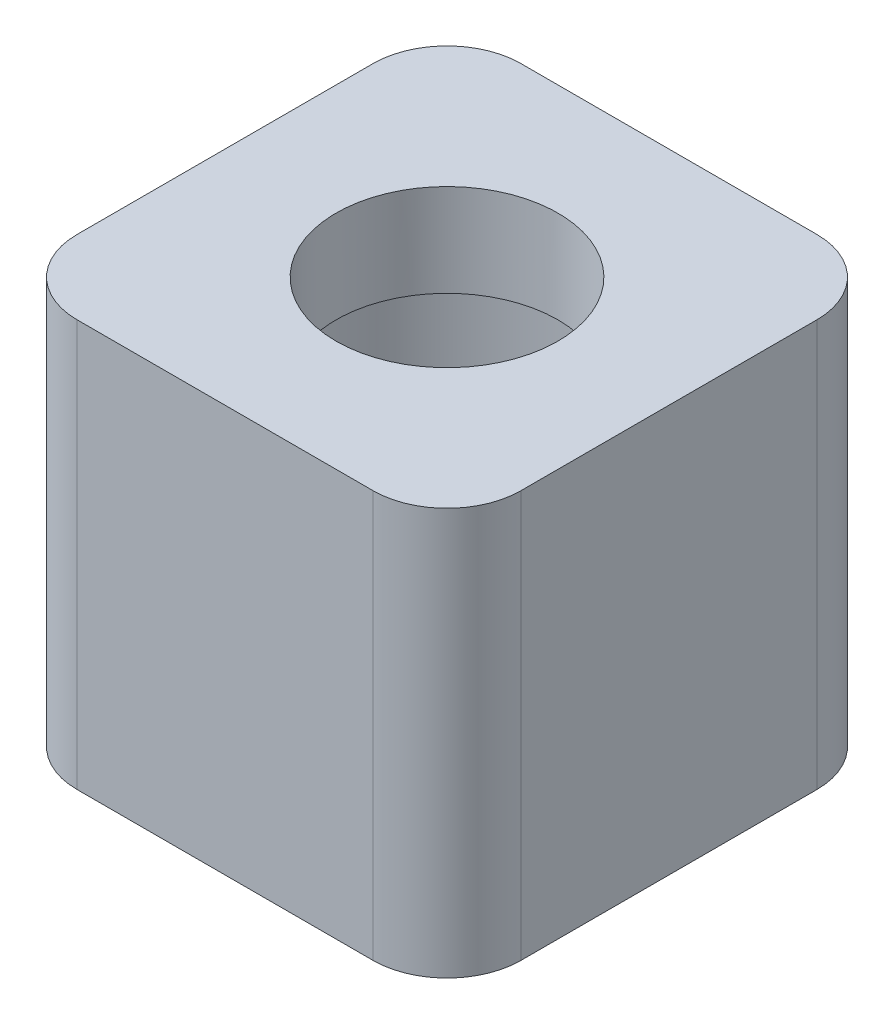
from build123d import *

# Parameters (mm, degrees)
BOSS_EXTRUDE1_DEPTH = 5.5
SKETCH2_R           = 1.5
CUT_EXTRUDE1_DEPTH  = 5.5
SKETCH3_R           = 2.25
CUT_EXTRUDE2_DEPTH  = 4.25


with BuildPart() as part:
    # Sketch1 → Boss-Extrude1 (new body)
    with BuildSketch(Plane(origin=(0, 0, 0), x_dir=(1, 0, 0), z_dir=(0, 1, 0))):
        with BuildLine():
            Line((-3.124927795, 3.313350367), (0.875072205, 3.313350367))
            ThreePointArc((0.875072205, 3.313350367), (1.582178986, 3.020457148), (1.875072205, 2.313350367))
            Line((1.875072205, 2.313350367), (1.875072205, -1.686649633))
            ThreePointArc((1.875072205, -1.686649633), (1.582178986, -2.393756414), (0.875072205, -2.686649633))
            Line((0.875072205, -2.686649633), (-3.124927795, -2.686649633))
            ThreePointArc((-3.124927795, -2.686649633), (-3.832034576, -2.393756414), (-4.124927795, -1.686649633))
            Line((-4.124927795, -1.686649633), (-4.124927795, 2.313350367))
            ThreePointArc((-4.124927795, 2.313350367), (-3.832034576, 3.020457148), (-3.124927795, 3.313350367))
        make_face()
    extrude(amount=BOSS_EXTRUDE1_DEPTH)

    # Sketch2 → Cut-Extrude1 (cut)
    with BuildSketch(Plane(origin=(0, 5.5, 0), x_dir=(1, 0, 0), z_dir=(0, 1, 0))):
        with Locations(Location((-1.124927795, 0.313350367, 0), (0, 0, 270))):
            Circle(SKETCH2_R)
    extrude(amount=-CUT_EXTRUDE1_DEPTH, mode=Mode.SUBTRACT)

    # Sketch3 → Cut-Extrude2 (cut)
    with BuildSketch(Plane.XZ):
        with Locations(Location((-1.124927795, -0.313350367, 0), (0, 0, 270))):
            Circle(SKETCH3_R)
    extrude(amount=-CUT_EXTRUDE2_DEPTH, mode=Mode.SUBTRACT)


solid = part.part
